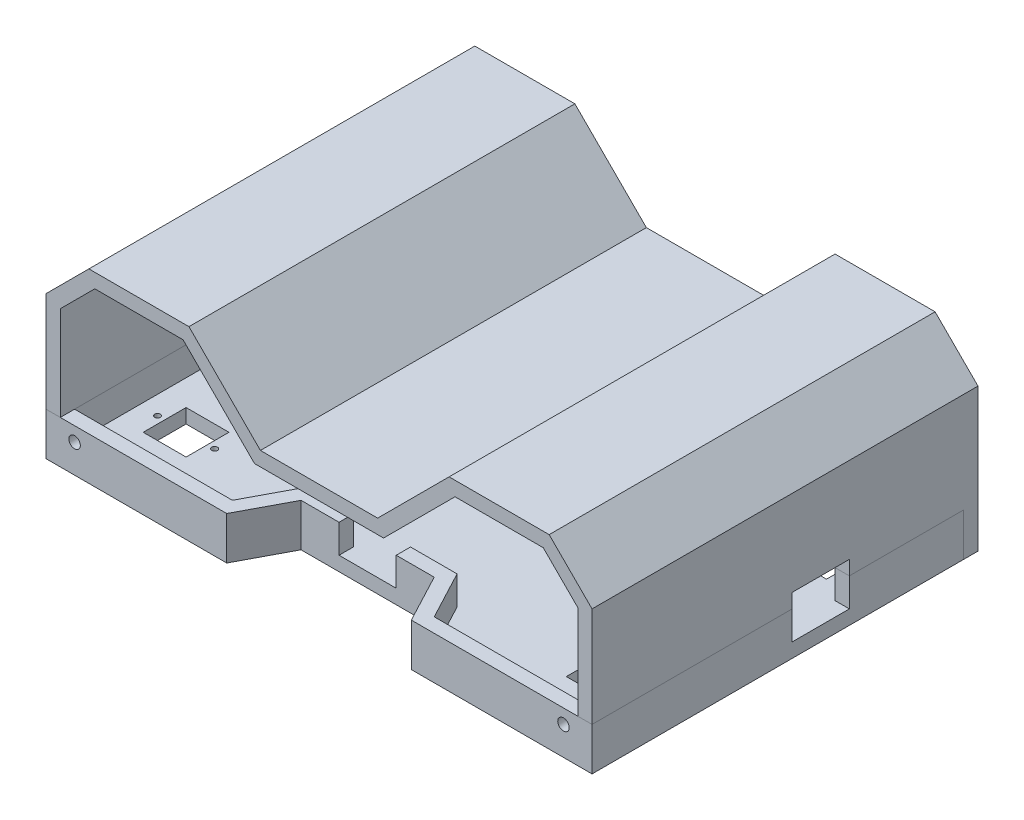
from build123d import *

# Parameters (mm, degrees)
BOSS_EXTRUDE2_DEPTH     = 15
SHELL1_T                = -5
CUT_EXTRUDE2_DEPTH      = 117.491415993
CUT_EXTRUDE2_DEPTH_BACK = 117.491415993
SKETCH4_R               = 1
SKETCH4_W               = 10
SKETCH4_H               = 12
SKETCH4_W_2             = 27
SKETCH4_H_2             = 20
SKETCH4_W_3             = 15
SKETCH4_H_3             = 15
SKETCH4_W_4             = 40
SKETCH5_W               = 3
SKETCH5_H               = 3
CUT_EXTRUDE4_DEPTH      = 117.491415993
SKETCH6_R               = 2
BOSS_EXTRUDE3_DEPTH     = 5
CUT_EXTRUDE5_DEPTH      = 178.68019023
CUT_EXTRUDE5_DEPTH_BACK = 178.68019023
SKETCH7_R               = 2
BOSS_EXTRUDE4_DEPTH     = 130
CHAMFER2_SIZE           = 3
SKETCH10_R              = 1.5
CUT_EXTRUDE6_DEPTH      = 5
SKETCH11_W              = 20
SKETCH11_H              = 10
CUT_EXTRUDE7_DEPTH      = 5
SKETCH12_W              = 20
SKETCH12_H              = 15
CUT_EXTRUDE8_DEPTH      = 6
FILLET1_R               = 3


with BuildPart() as part:
    # Sketch3 → Boss-Extrude2 (new body)
    with BuildSketch(Plane(origin=(0, 0, 0), x_dir=(1, 0, 0), z_dir=(0, 1, 0))):
        Polygon((95.5, 65), (-95.5, 65), (-95.5, -65), (-32.285430092, -65), (-23.285430092, -48), (23.285430092, -48), (32.285430092, -65), (95.5, -65), align=None)
    extrude(amount=BOSS_EXTRUDE2_DEPTH)

    # Shell1
    shell1_openings = [part.faces().sort_by_distance(p)[0] for p in [
        (0, 15, -2.252821678),
    ]]
    offset(amount=SHELL1_T, openings=shell1_openings, kind=Kind.INTERSECTION)

    # Sketch4 → Cut-Extrude2 (cut, two sides: drawn at the far end of the back side and taken through both)
    with BuildSketch(Plane(origin=(0, 0, 0), x_dir=(1, 0, 0), z_dir=(0, 1, 0)).offset(-CUT_EXTRUDE2_DEPTH_BACK)):
        with Locations(Location((-84, -37.5, 0), (0, 0, 270))):
            Circle(SKETCH4_R)
        with Locations(Location((-64, -37.5, 0), (0, 0, 270))):
            Circle(SKETCH4_R)
        with Locations((0, 15)):
            Rectangle(SKETCH4_W, SKETCH4_H)
        with Locations((68, -3)):
            Rectangle(SKETCH4_W_2, SKETCH4_H_2)
        with Locations((74, -37.5)):
            Rectangle(SKETCH4_W_3, SKETCH4_H_3)
        with Locations((-74, -37.5)):
            Rectangle(SKETCH4_W_3, SKETCH4_H_3)
        with Locations((62.5, 37.5)):
            Rectangle(SKETCH4_W_4, SKETCH4_H_3)
    extrude(amount=CUT_EXTRUDE2_DEPTH + CUT_EXTRUDE2_DEPTH_BACK, mode=Mode.SUBTRACT)

    # Sketch5 → Cut-Extrude4 (cut, through all)
    with BuildSketch(Plane(origin=(0, 0, 0), x_dir=(1, 0, 0), z_dir=(0, 1, 0))):
        with Locations((-84, 53.5)):
            Rectangle(SKETCH5_W, SKETCH5_H)
        with Locations((84, 53.5)):
            Rectangle(SKETCH5_W, SKETCH5_H)
        with Locations((84, -53.5)):
            Rectangle(SKETCH5_W, SKETCH5_H)
        with Locations((-84, -53.5)):
            Rectangle(SKETCH5_W, SKETCH5_H)
    extrude(amount=CUT_EXTRUDE4_DEPTH, mode=Mode.SUBTRACT)


with BuildPart() as body_2:
    # Sketch6 → Boss-Extrude3 (new body)
    with BuildSketch(Plane(origin=(0, 0, -65), x_dir=(-1, 0, 0), z_dir=(0, 0, -1))):
        Polygon((-95.5, 50), (-95.5, 0), (95.5, 0), (95.5, 50), (80.5, 65), (45.5, 65), (20.5, 40), (-20.5, 40), (-45.5, 65), (-80.5, 65), align=None)
        with Locations((-80.5, 30)):
            Circle(SKETCH6_R, mode=Mode.SUBTRACT)
        with Locations((-45.5, 30)):
            Circle(SKETCH6_R, mode=Mode.SUBTRACT)
    extrude(amount=BOSS_EXTRUDE3_DEPTH)


with BuildPart() as cut_extrude5_tool:
    # Sketch7 → Cut-Extrude5 (new, two sides: drawn at the far end of the back side and taken through both)
    with BuildSketch(Plane(origin=(0, 0, -70), x_dir=(-1, 0, 0), z_dir=(0, 0, -1)).offset(-CUT_EXTRUDE5_DEPTH_BACK)):
        with Locations(Location((-85.5, 10, 0), (0, 0, 180))):
            Circle(SKETCH7_R)
        with Locations(Location((85.5, 10, 0), (0, 0, 180))):
            Circle(SKETCH7_R)
    extrude(amount=CUT_EXTRUDE5_DEPTH + CUT_EXTRUDE5_DEPTH_BACK)


with BuildPart() as part_1:
    add(part.part)

    # Cut-Extrude5: cut by cut_extrude5_tool
    add(cut_extrude5_tool.part, mode=Mode.SUBTRACT)

    # Chamfer2
    chamfer2_edges = [part_1.edges().sort_by_distance(p)[0] for p in [
        (-5, 0, -15),
        (0, 0, -21),
        (5, 0, -15),
        (0, 0, -9),
    ]]
    chamfer(chamfer2_edges, length=CHAMFER2_SIZE)

    # Sketch10 → Cut-Extrude6 (cut)
    with BuildSketch(Plane.XZ):
        with Locations(Location((11.5, -3.5, 0), (0, 0, 270))):
            Circle(SKETCH10_R)
        with Locations(Location((11.5, -26.5, 0), (0, 0, 270))):
            Circle(SKETCH10_R)
        with Locations(Location((-11.5, -26.5, 0), (0, 0, 90))):
            Circle(SKETCH10_R)
        with Locations(Location((-11.5, -3.5, 0), (0, 0, 90))):
            Circle(SKETCH10_R)
    extrude(amount=-CUT_EXTRUDE6_DEPTH, mode=Mode.SUBTRACT)

    # Sketch11 → Cut-Extrude7 (cut)
    with BuildSketch(Plane.XY.offset(48)):
        with Locations((0, 10)):
            Rectangle(SKETCH11_W, SKETCH11_H)
    extrude(amount=-CUT_EXTRUDE7_DEPTH, mode=Mode.SUBTRACT)


with BuildPart() as body_2_1:
    add(body_2.part)

    # Cut-Extrude5: cut by cut_extrude5_tool
    add(cut_extrude5_tool.part, mode=Mode.SUBTRACT)

    # Sketch8 → Boss-Extrude4 (add)
    with BuildSketch(Plane.XY.offset(-65)):
        Polygon((45.5, 65), (20.5, 40), (-20.5, 40), (-45.5, 65), (-80.5, 65), (-95.5, 50), (-95.5, 15), (-90.5, 15), (-90.5, 47.928932188), (-78.428932188, 60), (-47.571067812, 60), (-22.571067812, 35), (22.571067812, 35), (47.571067812, 60), (78.428932188, 60), (90.5, 47.928932188), (90.5, 15), (95.5, 15), (95.5, 50), (80.5, 65), align=None)
    extrude(amount=BOSS_EXTRUDE4_DEPTH)


with BuildPart() as cut_extrude8_tool:
    # Sketch12 → Cut-Extrude8 (new body)
    with BuildSketch(Plane(origin=(95.5, 0, 0), x_dir=(0, 0, -1), z_dir=(1, 0, 0))):
        with Locations((15, 12.5)):
            Rectangle(SKETCH12_W, SKETCH12_H)
    extrude(amount=-CUT_EXTRUDE8_DEPTH)


with BuildPart() as part_2:
    add(part_1.part)

    # Cut-Extrude8: cut by cut_extrude8_tool
    add(cut_extrude8_tool.part, mode=Mode.SUBTRACT)


with BuildPart() as body_2_2:
    add(body_2_1.part)

    # Cut-Extrude8: cut by cut_extrude8_tool
    add(cut_extrude8_tool.part, mode=Mode.SUBTRACT)

    # Fillet1
    fillet1_edges = [body_2_2.edges().sort_by_distance(p)[0] for p in [
        (90.5, 20, -15),
    ]]
    fillet(fillet1_edges, radius=FILLET1_R)


solid = Compound([part_2.part, body_2_2.part])
